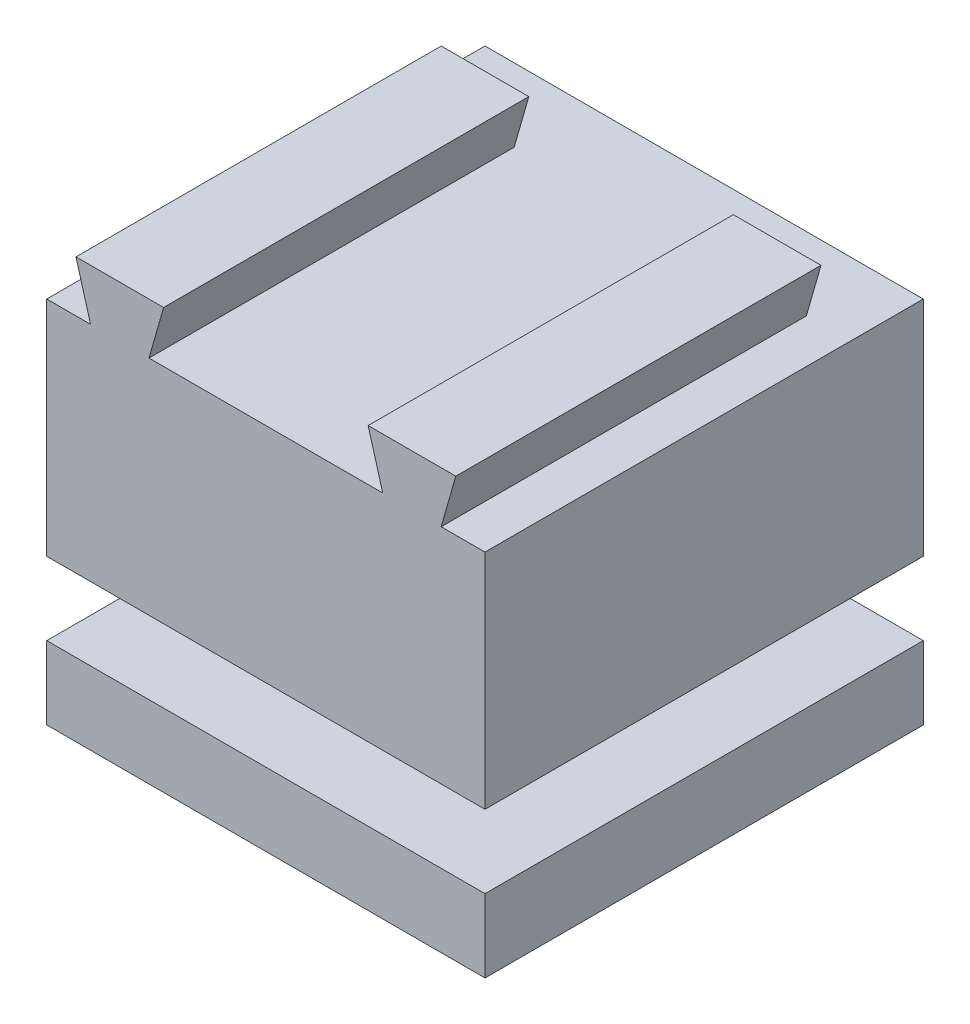
from build123d import *

# Parameters (mm, degrees)
CROQUIS2_W              = 60
CROQUIS2_H              = 60
SALIENTE_EXTRUIR1_DEPTH = 50.5
SALIENTE_EXTRUIR3_DEPTH = 50
MATRIZL2_COUNT          = 2
MATRIZL2_PITCH          = 40
CROQUIS5_W              = 10
CROQUIS5_H              = 10
CORTAR_EXTRUIR1_DEPTH   = 89.352985235
MATRIZL3_COUNT          = 2
MATRIZL3_PITCH          = 50
MATRIZC1_COUNT          = 2
MATRIZC1_ANGLE          = 90


with BuildPart() as part:
    # Croquis2 → Saliente-Extruir1 (new body)
    with BuildSketch(Plane(origin=(0, 0, 0), x_dir=(1, 0, 0), z_dir=(0, 1, 0))):
        Rectangle(CROQUIS2_W, CROQUIS2_H)
    extrude(amount=SALIENTE_EXTRUIR1_DEPTH)

    # Croquis4 → Saliente-Extruir3 (add)
    with BuildSketch(Plane.XY.offset(30)):
        Polygon((-26, 57.5), (-14, 57.5), (-16, 50.5), (-24, 50.5), align=None)
    saliente_extruir3 = extrude(amount=-SALIENTE_EXTRUIR3_DEPTH)

    # MatrizL2: Saliente-Extruir3 ×2
    with Locations(*[(i * MATRIZL2_PITCH, 0, 0) for i in range(1, MATRIZL2_COUNT)]):
        add(saliente_extruir3)

    # Croquis5 → Cortar-Extruir1 (cut, through all)
    with BuildSketch(Plane.XY.offset(30)):
        with Locations((-25, 15)):
            Rectangle(CROQUIS5_W, CROQUIS5_H)
    cortar_extruir1 = extrude(amount=-CORTAR_EXTRUIR1_DEPTH, mode=Mode.SUBTRACT)

    # MatrizL3: Cortar-Extruir1 ×2
    with Locations(*[(i * MATRIZL3_PITCH, 0, 0) for i in range(1, MATRIZL3_COUNT)]):
        add(cortar_extruir1, mode=Mode.SUBTRACT)

    # MatrizC1: Cortar-Extruir1 ×2 about axis
    matrizc1_axis = Axis((0, 0, 0), (0, 1, 0))
    for i in range(1, MATRIZC1_COUNT):
        add(cortar_extruir1.rotate(matrizc1_axis, i * MATRIZC1_ANGLE / (MATRIZC1_COUNT - 1)), mode=Mode.SUBTRACT)


solid = part.part
